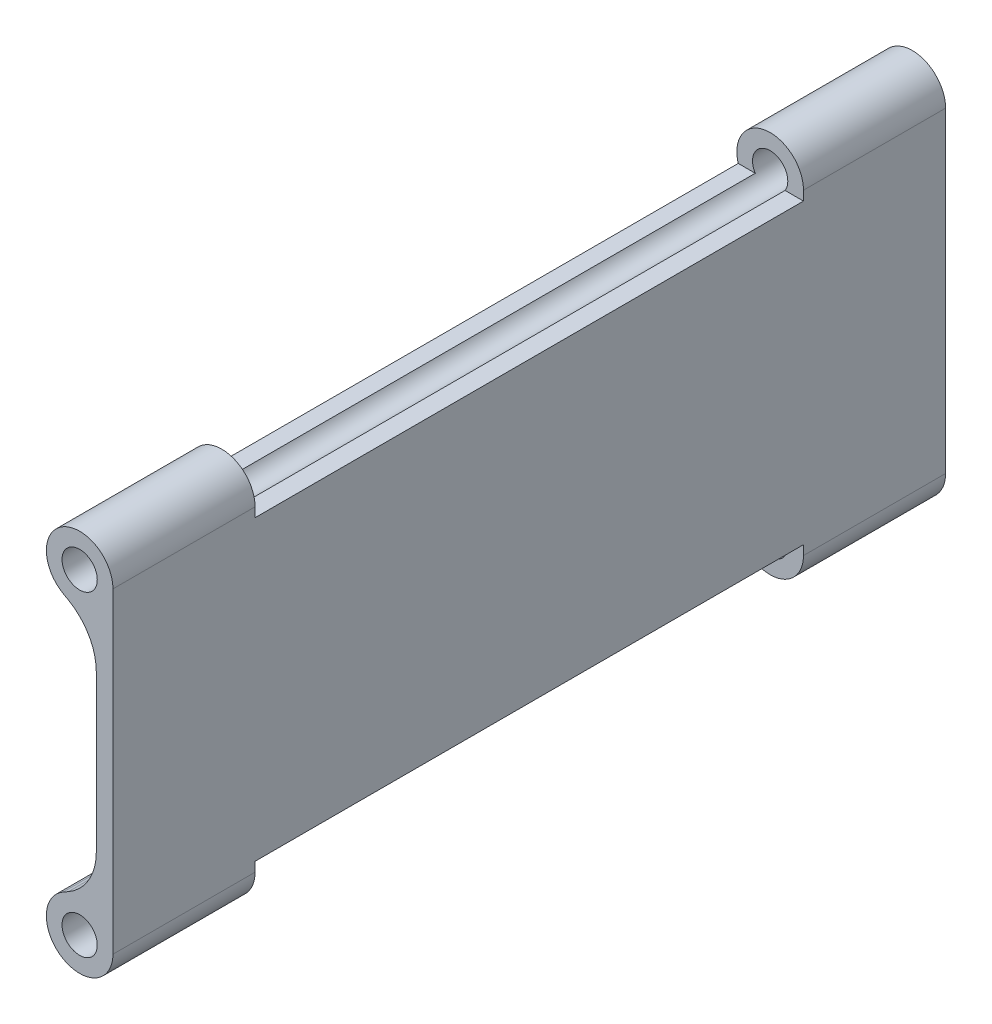
from build123d import *

# Parameters (mm, degrees)
CROQUIS1_R              = 3.175
SALIENTE_EXTRUIR1_DEPTH = 150
REDONDEO1_R             = 10
CROQUIS3_W              = 98.791812306
CROQUIS3_H              = 18.145434914
CORTAR_EXTRUIR2_DEPTH   = 155.383451186


with BuildPart() as part:
    # Croquis1 → Saliente-Extruir1 (new body)
    with BuildSketch(Plane.XY):
        with BuildLine():
            Line((-3, 19.859827637), (-8.98691391, 23.296314259))
            ThreePointArc((-8.98691391, 23.296314259), (-9.006535925, 33.69237342), (0, 28.5))
            Line((0, 28.5), (0, -28.5))
            ThreePointArc((0, -28.5), (-9.006535925, -33.69237342), (-8.98691391, -23.296314259))
            Line((-8.98691391, -23.296314259), (-3, -19.859827637))
            Line((-3, -19.859827637), (-3, 19.859827637))
        make_face()
        with Locations((-6, 28.5)):
            Circle(CROQUIS1_R, mode=Mode.SUBTRACT)
        with Locations(Location((-6, -28.5, 0), (0, 0, 180))):
            Circle(CROQUIS1_R, mode=Mode.SUBTRACT)
    extrude(amount=-SALIENTE_EXTRUIR1_DEPTH)

    # Redondeo1
    redondeo1_edges = [part.edges().sort_by_distance(p)[0] for p in [
        (-3, -19.859827637, -75),
        (-3, 19.859827637, -75),
    ]]
    fillet(redondeo1_edges, radius=REDONDEO1_R)

    # Croquis3 → Cortar-Extruir2 (cut, through all)
    with BuildSketch(Plane(origin=(0, 0, 0), x_dir=(0, 0, -1), z_dir=(1, 0, 0))):
        with Locations((75, 35.875128035)):
            Rectangle(CROQUIS3_W, CROQUIS3_H)
        with Locations((75, -35.875128035)):
            Rectangle(CROQUIS3_W, CROQUIS3_H)
    extrude(amount=-CORTAR_EXTRUIR2_DEPTH, mode=Mode.SUBTRACT)


solid = part.part
